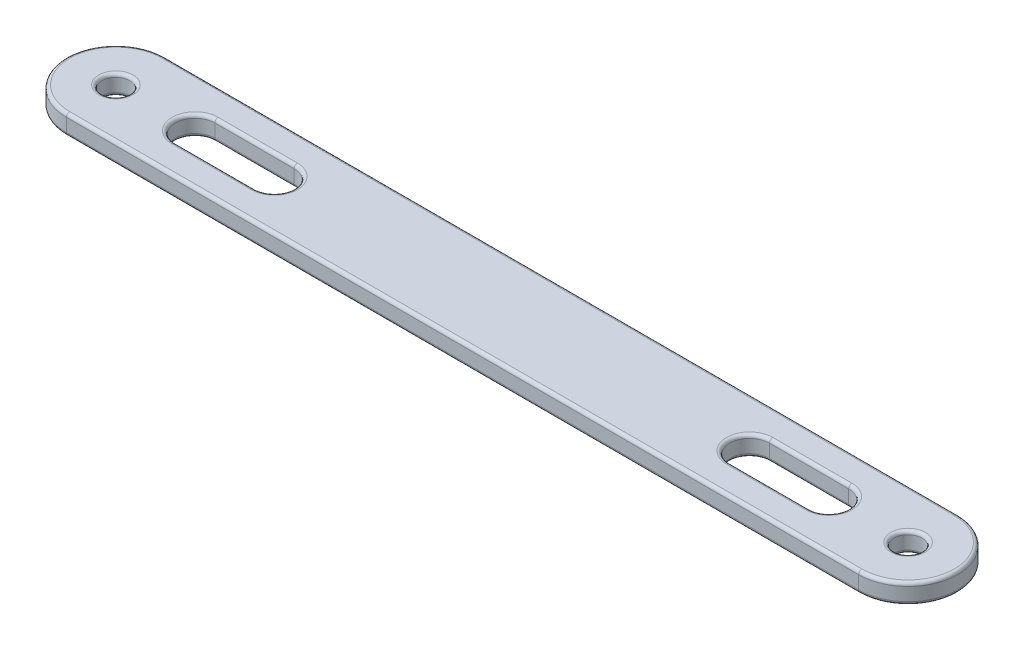
from build123d import *

# Parameters (mm, degrees)
SKETCH1_R           = 2.1
BOSS_EXTRUDE1_DEPTH = 3
CUT_EXTRUDE1_DEPTH  = 128.755626099
FILLET1_R           = 0.5


with BuildPart() as part:
    # Sketch1 → Boss-Extrude1 (new body)
    with BuildSketch(Plane(origin=(0, 0, 0), x_dir=(1, 0, 0), z_dir=(0, 1, 0))):
        with BuildLine():
            Line((0, 7.5), (120, 7.5))
            ThreePointArc((120, 7.5), (127.5, 0), (120, -7.5))
            Line((120, -7.5), (0, -7.5))
            ThreePointArc((0, -7.5), (-7.5, 0), (0, 7.5))
        make_face()
        with Locations(Location((0, 0, 0), (0, 0, 270))):
            Circle(SKETCH1_R, mode=Mode.SUBTRACT)
        with Locations(Location((120, 0, 0), (0, 0, 270))):
            Circle(SKETCH1_R, mode=Mode.SUBTRACT)
    extrude(amount=BOSS_EXTRUDE1_DEPTH)

    # Sketch3 → Cut-Extrude1 (cut, through all)
    with BuildSketch(Plane(origin=(0, 3, 0), x_dir=(1, 0, 0), z_dir=(0, 1, 0))):
        with BuildLine():
            Line((12, 3), (24, 3))
            ThreePointArc((24, 3), (27, 0), (24, -3))
            Line((24, -3), (12, -3))
            ThreePointArc((12, -3), (9, 0), (12, 3))
        make_face()
        with BuildLine():
            Line((108, 3), (96, 3))
            ThreePointArc((96, 3), (93, 0), (96, -3))
            Line((96, -3), (108, -3))
            ThreePointArc((108, -3), (111, 0), (108, 3))
        make_face()
    extrude(amount=-CUT_EXTRUDE1_DEPTH, mode=Mode.SUBTRACT)

    # Fillet1
    fillet1_edges = [part.edges().sort_by_distance(p)[0] for p in [
        (-7.5, 3, 0),
        (0, 0, -2.1),
        (0, 3, -2.1),
        (60, 3, 7.5),
        (120, 0, -2.1),
        (120, 3, -2.1),
        (9, 0, 0),
        (18, 0, -3),
        (27, 0, 0),
        (18, 0, 3),
        (9, 3, 0),
        (18, 3, 3),
        (27, 3, 0),
        (18, 3, -3),
        (111, 0, 0),
        (127.5, 3, 0),
        (102, 0, 3),
        (93, 0, 0),
        (102, 0, -3),
        (111, 3, 0),
        (102, 3, -3),
        (93, 3, 0),
        (102, 3, 3),
        (60, 0, 7.5),
        (-7.5, 0, 0),
        (60, 0, -7.5),
        (127.5, 0, 0),
        (60, 3, -7.5),
    ]]
    fillet(fillet1_edges, radius=FILLET1_R)


solid = part.part
